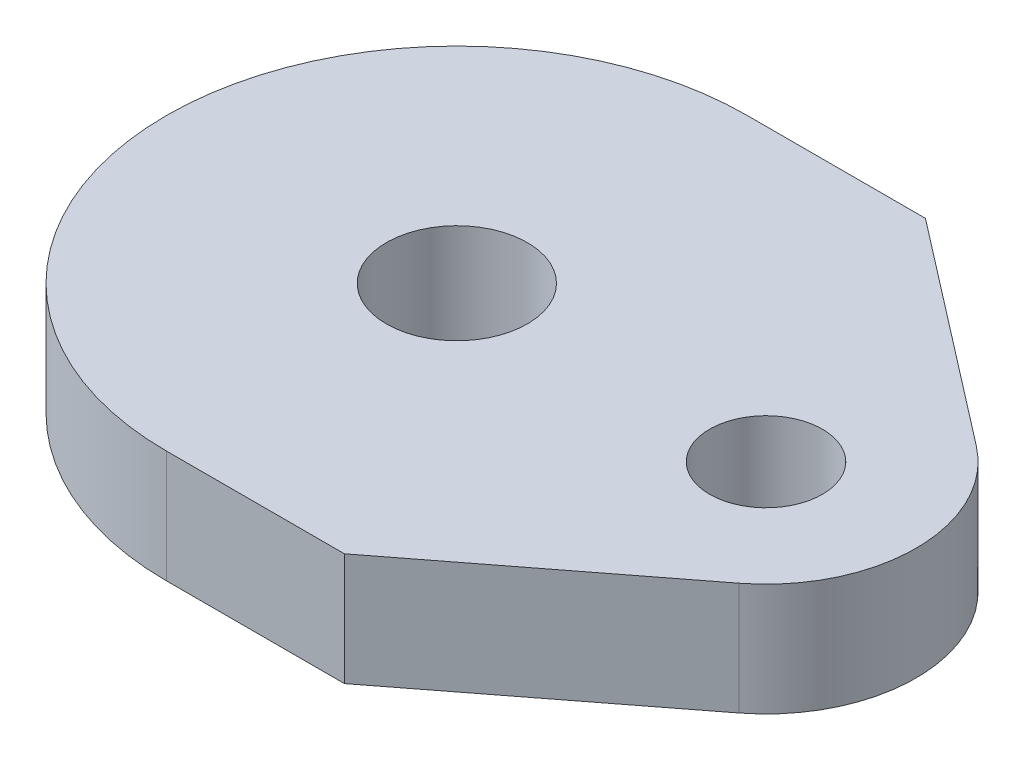
from build123d import *

# Parameters (mm, degrees)
SKETCH1_R           = 3.98145
SKETCH1_R_2         = 3.1877
BOSS_EXTRUDE1_DEPTH = 6.35


with BuildPart() as part:
    # Sketch1 → Boss-Extrude1 (new body)
    with BuildSketch(Plane(origin=(0, 0, 0), x_dir=(1, 0, 0), z_dir=(0, 1, 0))):
        with BuildLine():
            Line((0, 0), (10.0584, 0))
            Line((10.0584, 0), (22.635934302, 9.700812927))
            ThreePointArc((22.635934302, 9.700812927), (25.9334, 16.4084), (22.635934302, 23.115987073))
            Line((22.635934302, 23.115987073), (10.0584, 32.8168))
            Line((10.0584, 32.8168), (0, 32.8168))
            ThreePointArc((0, 32.8168), (-16.4084, 16.4084), (0, 0))
        make_face()
        with Locations(Location((0, 16.4084, 0), (0, 0, 270))):
            Circle(SKETCH1_R, mode=Mode.SUBTRACT)
        with Locations(Location((17.4625, 16.4084, 0), (0, 0, 270))):
            Circle(SKETCH1_R_2, mode=Mode.SUBTRACT)
    extrude(amount=BOSS_EXTRUDE1_DEPTH)


solid = part.part
